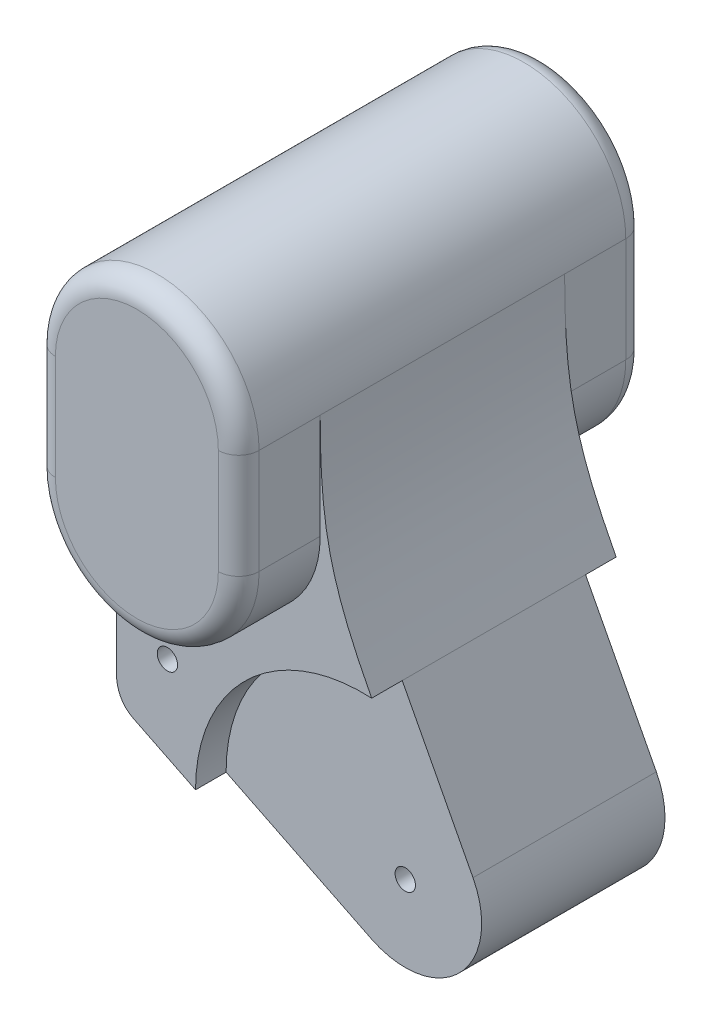
from build123d import *

# Parameters (mm, degrees)
SKETCHDISTALINTERNAL_R          = 0.5
BOSSEXTRUDEDISTALINTERNAL_DEPTH = 12
CUTEXTRUDEDISTALBARL_START      = -1.5
CUTEXTRUDEDISTALBARL_DEPTH      = 1.5
CUTEXTRUDEDISTALBARR_DEPTH      = 1.5
BOSSEXTRUDEEXTERNAL_START       = -16
BOSSEXTRUDEEXTERNAL_DEPTH       = 20
FILLETDISTALEXTERNAL_R          = 1


with BuildPart() as part:
    # SketchDistalInternal → BossExtrudeDistalInternal (new body)
    with BuildSketch(Plane.XY):
        with BuildLine():
            Line((0.839496756, -1.48710509), (11.016133562, -6.51289491))
            ThreePointArc((11.016133562, -6.51289491), (15.358517882, -5.771641109), (16, -1.4134007))
            Line((16, -1.4134007), (12.527091293, 5.230590272))
            add(Edge.make_bspline(
                [(10, 16), (10, 11.295651098), (10.473683301, 9.158946966), (12.527091293, 5.230590272)],
                knots=[0, 0, 0, 0, 1, 1, 1, 1], degree=3))
            ThreePointArc((10, 16), (5, 21), (0, 16))
            Line((0, 16), (0, 0))
            add(Edge.make_bspline(
                [(0, 0), (0, -0.54020277), (0.191605084, -1.167140113), (0.839496756, -1.48710509)],
                knots=[0, 0, 0, 0, 1, 1, 1, 1], degree=3))
        make_face()
        with Locations((2.5, 1.875219846)):
            Circle(SKETCHDISTALINTERNAL_R, mode=Mode.SUBTRACT)
        with Locations((12.676636807, -3.150569974)):
            Circle(SKETCHDISTALINTERNAL_R, mode=Mode.SUBTRACT)
    extrude(amount=BOSSEXTRUDEDISTALINTERNAL_DEPTH)

    # SketchCutBarL → CutExtrudeDistalBarL (cut)
    with BuildSketch(Plane.XY.offset(12).offset(CUTEXTRUDEDISTALBARL_START)):
        with BuildLine():
            Line((3.880618629, -2.98898038), (11.016133562, -6.51289491))
            ThreePointArc((11.016133562, -6.51289491), (15.358517882, -5.771641109), (16, -1.4134007))
            Line((16, -1.4134007), (12.527091293, 5.230590272))
            ThreePointArc((12.527091293, 5.230590272), (6.43792312, 2.978454456), (3.880618629, -2.98898038))
        make_face()
    extrude(amount=CUTEXTRUDEDISTALBARL_DEPTH, mode=Mode.SUBTRACT)

    # SketchCutBarR → CutExtrudeDistalBarR (cut)
    with BuildSketch(Plane.XY):
        with BuildLine():
            Line((3.880618629, -2.98898038), (11.016133562, -6.51289491))
            ThreePointArc((11.016133562, -6.51289491), (15.358517882, -5.771641109), (16, -1.4134007))
            Line((16, -1.4134007), (12.527091293, 5.230590272))
            ThreePointArc((12.527091293, 5.230590272), (6.43792312, 2.978454456), (3.880618629, -2.98898038))
        make_face()
    extrude(amount=CUTEXTRUDEDISTALBARR_DEPTH, mode=Mode.SUBTRACT)

    # SketchDistalExternal → BossExtrudeExternal (add)
    with BuildSketch(Plane.XY.offset(12).offset(BOSSEXTRUDEEXTERNAL_START)):
        with BuildLine():
            Line((0, 16), (0, 10.850906929))
            ThreePointArc((0, 10.850906929), (5, 5.850906929), (10, 10.850906929))
            Line((10, 10.850906929), (10, 16))
            ThreePointArc((10, 16), (5, 21), (0, 16))
        make_face()
    extrude(amount=BOSSEXTRUDEEXTERNAL_DEPTH)

    # FilletDistalExternal
    filletdistalexternal_edges = [part.edges().sort_by_distance(p)[0] for p in [
        (5, 21, -4),
        (10, 13.425453465, -4),
        (5, 5.850906929, -4),
        (0, 13.425453465, -4),
        (5, 21, 16),
        (0, 13.425453465, 16),
        (5, 5.850906929, 16),
        (10, 13.425453465, 16),
    ]]
    fillet(filletdistalexternal_edges, radius=FILLETDISTALEXTERNAL_R)


solid = part.part
